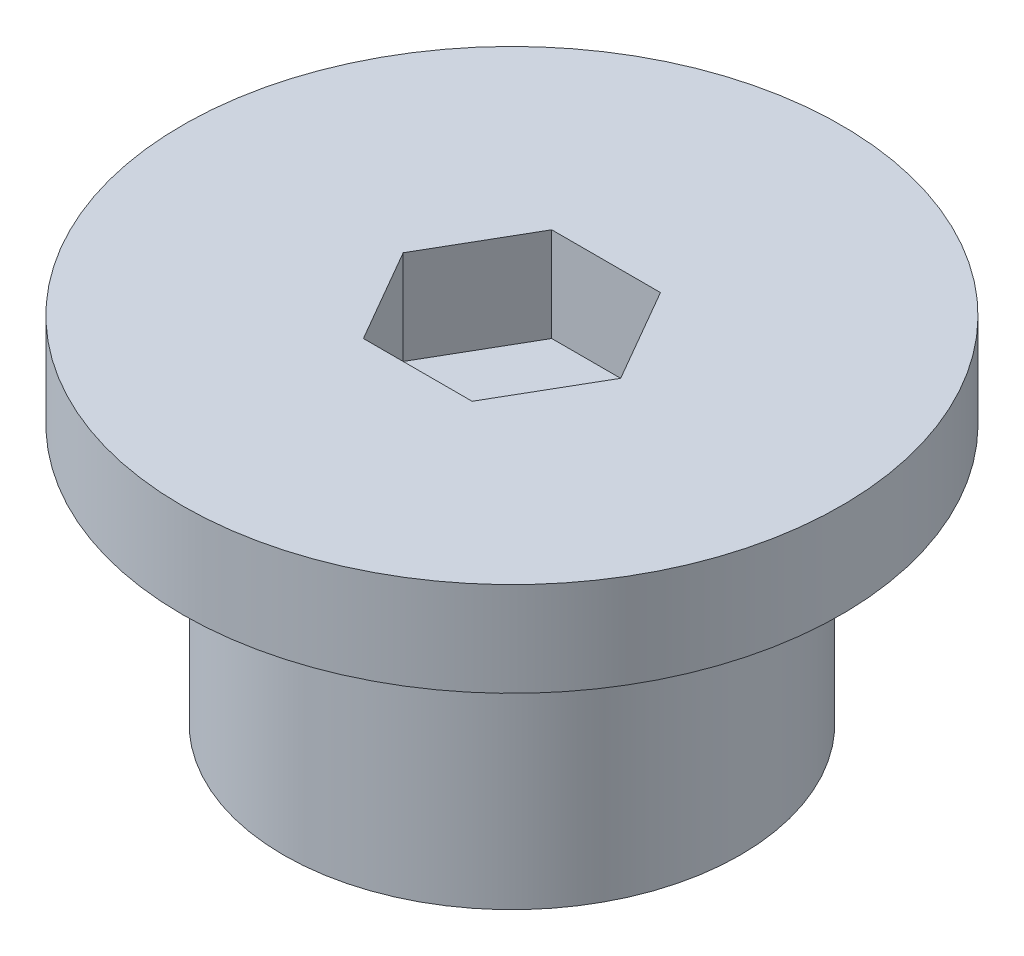
from build123d import *

# Parameters (mm, degrees)
CUT_EXTRUDE_1_DEPTH = 2


with BuildPart() as part:
    # Эскиз1 → Повернуть1 (revolve)
    with BuildSketch(Plane.XY, mode=Mode.PRIVATE) as revolve_1_sk:
        Polygon((0, 7.5), (7, 7.5), (7, 5.5), (4.85, 5.5), (4.85, 0), (0, 0), align=None)
    revolve(revolve_1_sk.sketch.rotate(Axis((0, 21.439331355, 0), (0, -1, 0)), 90), axis=Axis((0, 21.439331355, 0), (0, -1, 0)))

    # Эскиз2 → Вырез-Вытянуть1 (cut)
    with BuildSketch(Plane(origin=(0, 7.5, 0), x_dir=(1, 0, 0), z_dir=(0, 1, 0))):
        Polygon((2.309401077, 0), (1.154700538, 2), (-1.154700538, 2), (-2.309401077, 0), (-1.154700538, -2), (1.154700538, -2), align=None)
    extrude(amount=-CUT_EXTRUDE_1_DEPTH, mode=Mode.SUBTRACT)


solid = part.part
